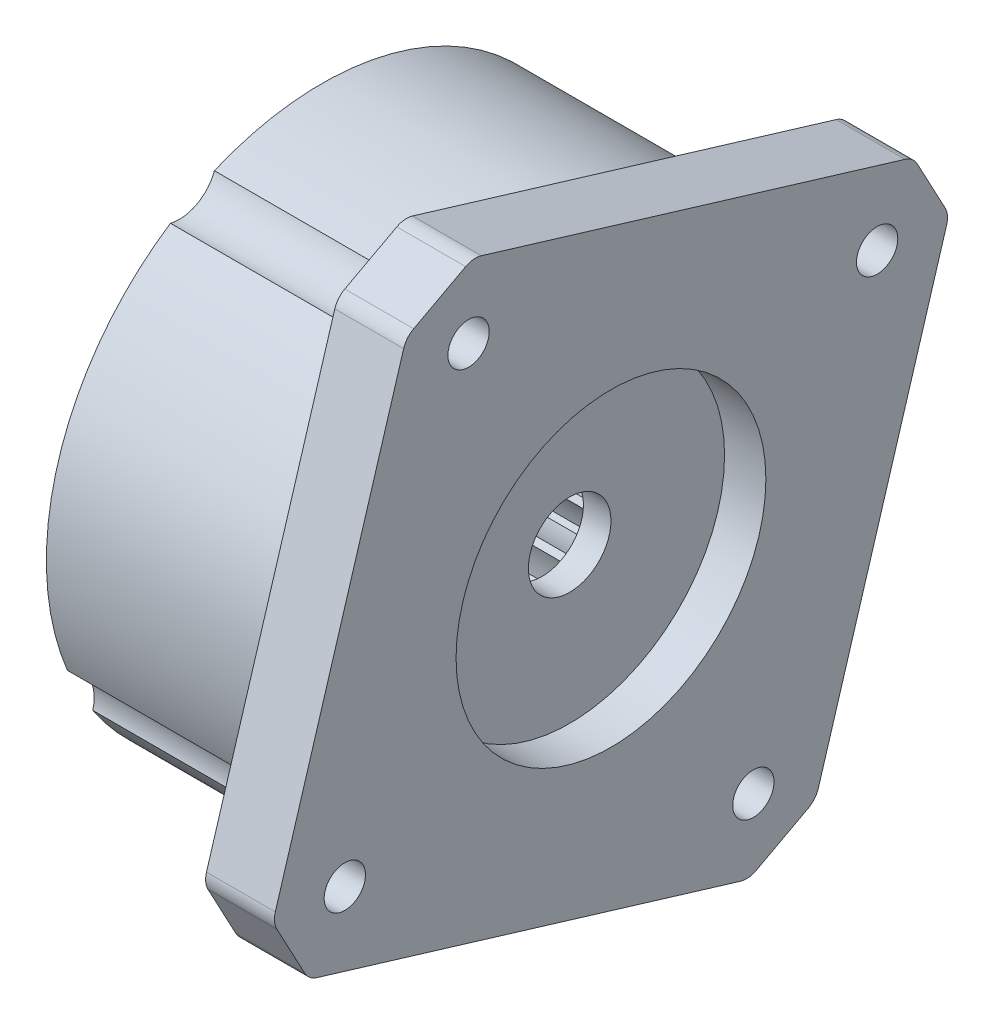
from build123d import *

# Parameters (mm, degrees)
BASPROSKE_W         = 16
BASPROSKE_H         = 6
TOOTHCUT_DEPTH      = 33.496153619
TEETHCUTS_COUNT     = 30
TEETHCUTS_ANGLE     = 348
SKETCH1_R           = 1.5
SKETCH1_R_2         = 3
BOSS_EXTRUDE2_DEPTH = 5
SKETCH2_R           = 11.25
CUT_EXTRUDE1_DEPTH  = 3
SKETCH3_R           = 2.7
SKETCH3_R_2         = 2.8
CUT_EXTRUDE2_DEPTH  = 39.085895206
FILLET1_R           = 0.5


with BuildPart() as part:
    # BasProSke → Base-Revolve (revolve)
    with BuildSketch(Plane(origin=(0, 0, 0), x_dir=(1, 0, 0), z_dir=(0, 1, 0)), mode=Mode.PRIVATE) as base_revolve_sk:
        with Locations((8, 17)):
            Rectangle(BASPROSKE_W, BASPROSKE_H)
    revolve(base_revolve_sk.sketch.rotate(Axis((-10, 0, 0), (1, 0, 0)), 180), axis=Axis((-10, 0, 0), (1, 0, 0)))

    # TooCutSke → ToothCut (cut, through all)
    with BuildSketch(Plane(origin=(0, 0, 0), x_dir=(0, 0, -1), z_dir=(1, 0, 0))):
        with BuildLine():
            ThreePointArc((1.225068537, 13.920799267), (0.814347271, 15.128804606), (0.204805405, 16.249709405))
            ThreePointArc((0.204805405, 16.249709405), (0, 16.251), (-0.204805405, 16.249709405))
            ThreePointArc((-0.204805405, 16.249709405), (-0.814347271, 15.128804606), (-1.225068537, 13.920799267))
            ThreePointArc((-1.225068537, 13.920799267), (0, 13.9746), (1.225068537, 13.920799267))
        make_face()
    toothcut = extrude(amount=TOOTHCUT_DEPTH, mode=Mode.SUBTRACT)

    # TeethCuts: ToothCut ×30 about axis
    teethcuts_axis = Axis((-10, 0, 0), (1, 0, 0))
    for i in range(1, TEETHCUTS_COUNT):
        add(toothcut.rotate(teethcuts_axis, i * TEETHCUTS_ANGLE / (TEETHCUTS_COUNT - 1)), mode=Mode.SUBTRACT)

    # Sketch1 → Boss-Extrude2 (add)
    with BuildSketch(Plane(origin=(16, 0, 0), x_dir=(0, 0, -1), z_dir=(1, 0, 0))):
        with BuildLine():
            Line((-15.055953922, 21.353540835), (-24.374641, -9.409162068))
            ThreePointArc((-24.374641, -9.409162068), (-24.431780825, -9.991637084), (-24.261667602, -10.551640294))
            Line((-24.261667602, -10.551640294), (-22.241279191, -14.327984076))
            ThreePointArc((-22.241279191, -14.327984076), (-21.869811115, -14.780260068), (-21.353540835, -15.055953922))
            Line((-21.353540835, -15.055953922), (9.409162068, -24.374641))
            ThreePointArc((9.409162068, -24.374641), (9.991637084, -24.431780825), (10.551640294, -24.261667602))
            Line((10.551640294, -24.261667602), (14.327984076, -22.241279191))
            ThreePointArc((14.327984076, -22.241279191), (14.780260068, -21.869811115), (15.055953922, -21.353540835))
            Line((15.055953922, -21.353540835), (24.374641, 9.409162068))
            ThreePointArc((24.374641, 9.409162068), (24.431780825, 9.991637084), (24.261667602, 10.551640294))
            Line((24.261667602, 10.551640294), (22.241279191, 14.327984076))
            ThreePointArc((22.241279191, 14.327984076), (21.869811115, 14.780260068), (21.353540835, 15.055953922))
            Line((21.353540835, 15.055953922), (-9.409162068, 24.374641))
            ThreePointArc((-9.409162068, 24.374641), (-9.991637084, 24.431780825), (-10.551640294, 24.261667602))
            Line((-10.551640294, 24.261667602), (-14.327984076, 22.241279191))
            ThreePointArc((-14.327984076, 22.241279191), (-14.780260068, 21.869811115), (-15.055953922, 21.353540835))
        make_face()
        with Locations((19.327963402, 10.340688116)):
            Circle(SKETCH1_R, mode=Mode.SUBTRACT)
        with Locations((-10.340688116, 19.327963402)):
            Circle(SKETCH1_R, mode=Mode.SUBTRACT)
        with Locations((-19.327963402, -10.340688116)):
            Circle(SKETCH1_R, mode=Mode.SUBTRACT)
        with Locations((10.340688116, -19.327963402)):
            Circle(SKETCH1_R, mode=Mode.SUBTRACT)
        Circle(SKETCH1_R_2, mode=Mode.SUBTRACT)
    extrude(amount=BOSS_EXTRUDE2_DEPTH)

    # Sketch2 → Cut-Extrude1 (cut)
    with BuildSketch(Plane(origin=(21, 0, 0), x_dir=(0, 0, -1), z_dir=(1, 0, 0))):
        Circle(SKETCH2_R)
    extrude(amount=-CUT_EXTRUDE1_DEPTH, mode=Mode.SUBTRACT)

    # Sketch3 → Cut-Extrude2 (cut, through all)
    with BuildSketch(Plane.ZY.offset(-16)):
        with Locations((10.340688116, 19.327963402)):
            Circle(SKETCH3_R)
        with Locations((19.327963402, -10.340688116)):
            Circle(SKETCH3_R_2)
        with Locations((-10.340688116, -19.327963402)):
            Circle(SKETCH3_R_2)
        with Locations((-19.327963402, 10.340688116)):
            Circle(SKETCH3_R_2)
    extrude(amount=CUT_EXTRUDE2_DEPTH, mode=Mode.SUBTRACT)

    # Fillet1
    fillet1_edges = [part.edges().sort_by_distance(p)[0] for p in [
        (16, 19.160329276, -5.734263862),
        (16, 5.862155665, 19.121588087),
        (16, -19.141065496, 5.79824212),
        (16, -5.79824212, -19.141065496),
    ]]
    fillet(fillet1_edges, radius=FILLET1_R)


solid = part.part
